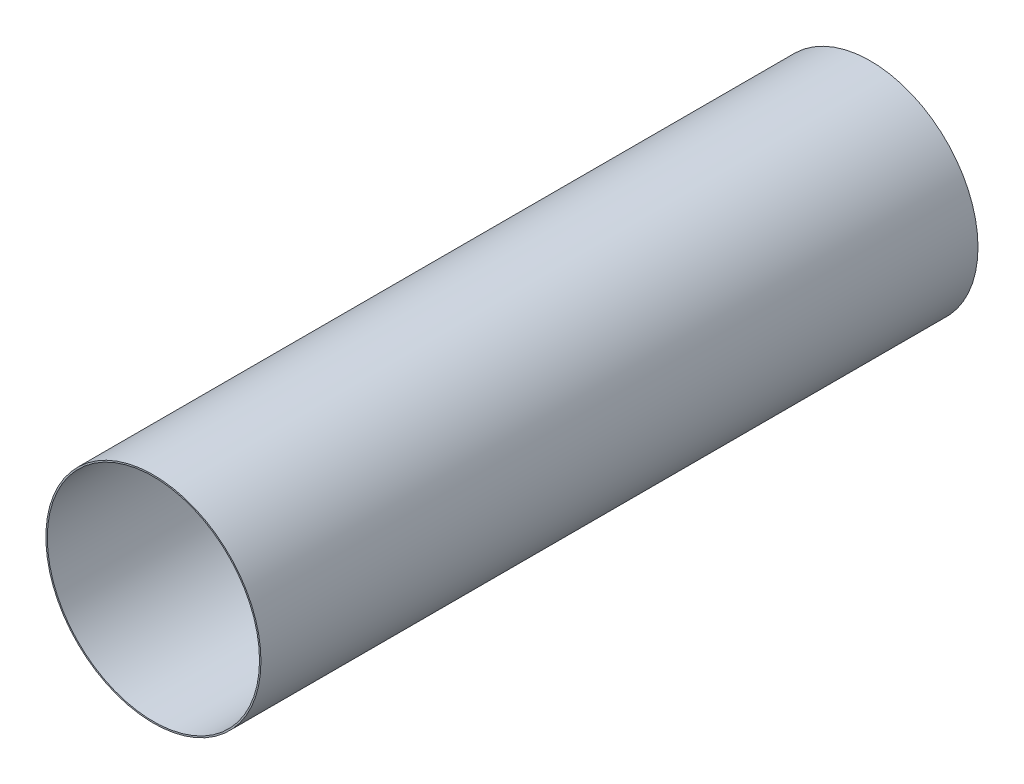
from build123d import *

# Parameters (mm, degrees)
SKETCH_1_R      = 150
EXTRUDE_1_DEPTH = 1000
SHELL_1_T       = -2


with BuildPart() as part:
    # ｽｹｯﾁ1 → ﾎﾞｽ - 押し出し1 (new body)
    with BuildSketch(Plane.XY):
        Circle(SKETCH_1_R)
    extrude(amount=EXTRUDE_1_DEPTH)

    # ｼｪﾙ1
    shell_1_openings = [part.faces().sort_by_distance(p)[0] for p in [
        (0, 0, 1000),
    ]]
    offset(amount=SHELL_1_T, openings=shell_1_openings, kind=Kind.INTERSECTION)


solid = part.part
